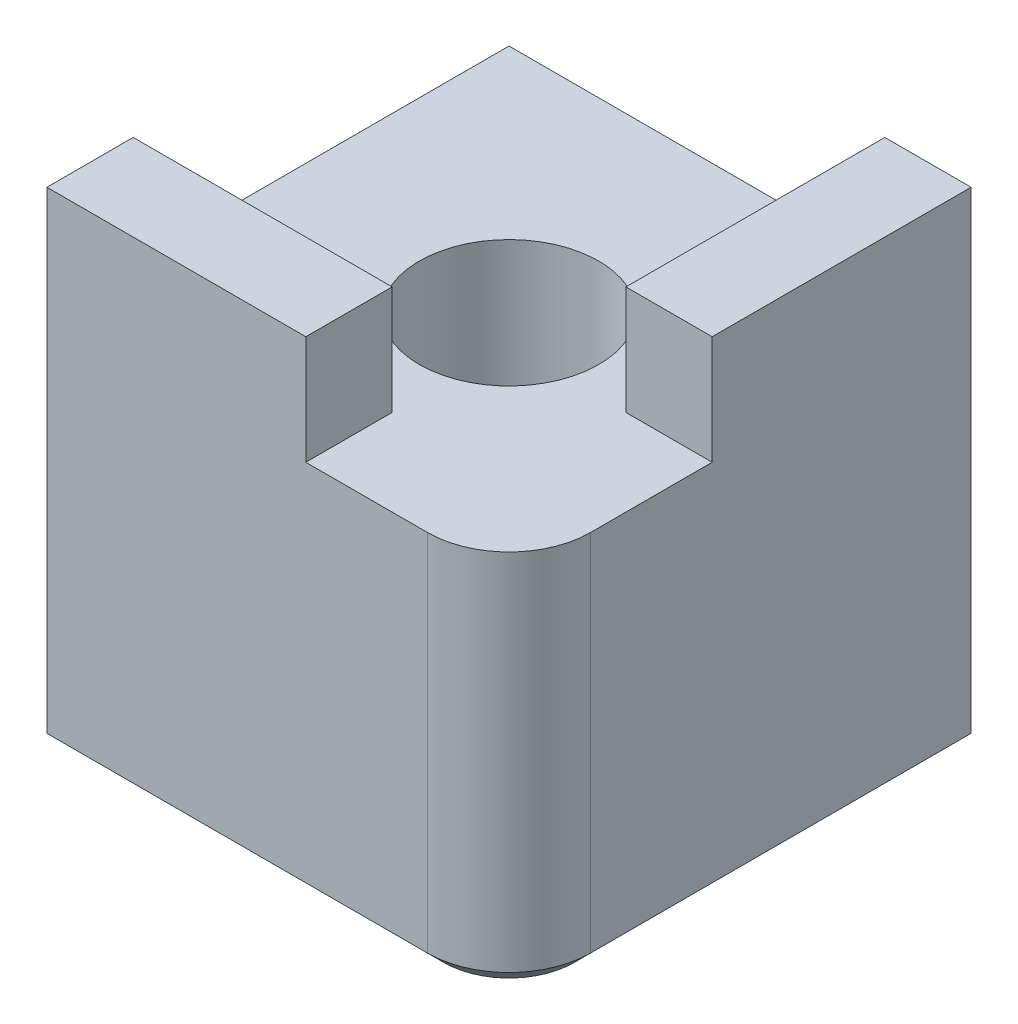
from build123d import *

# Parameters (mm, degrees)
BASE_W                = 8.5
BASE_H                = 8.5
BOSS_EXTRUDE1_DEPTH   = 8.5
CUTOUT_W              = 7
CUTOUT_H              = 7
CUT_EXTRUDE1_DEPTH    = 1.5
SKETCH3_W             = 1.5
SKETCH3_H             = 1.5
CUT_EXTRUDE2_DEPTH    = 12.803071634
FILLET3_R             = 0.508
FILLET4_R             = 1.5
M4_TAPPED_HOLE1_D     = 3.3
M4_TAPPED_HOLE1_DEPTH = 5
M4_TAPPED_HOLE1_TIP   = 0.991420021
CUT_EXTRUDE3_START    = -1.5
CUT_EXTRUDE3_DEPTH    = 1.5
CHAMFER1_SIZE         = 0.3
SKETCH15_W            = 1.5875
SKETCH15_H            = 4.7625
SKETCH15_W_2          = 4.7625
SKETCH15_H_2          = 1.5875
BOSS_EXTRUDE2_DEPTH   = 2


with BuildPart() as part:
    # Base → Boss-Extrude1 (new body)
    with BuildSketch(Plane(origin=(0, 0, 0), x_dir=(1, 0, 0), z_dir=(0, 1, 0))):
        Rectangle(BASE_W, BASE_H)
    extrude(amount=-BOSS_EXTRUDE1_DEPTH)

    # Cutout → Cut-Extrude1 (cut)
    with BuildSketch(Plane(origin=(0, 0, 0), x_dir=(1, 0, 0), z_dir=(0, 1, 0))):
        with Locations((-0.75, 0.75)):
            Rectangle(CUTOUT_W, CUTOUT_H)
    extrude(amount=-CUT_EXTRUDE1_DEPTH, mode=Mode.SUBTRACT)

    # Sketch3 → Cut-Extrude2 (cut, through all)
    with BuildSketch(Plane.ZY.offset(-2.75)):
        with Locations((-3.5, -0.75)):
            Rectangle(SKETCH3_W, SKETCH3_H)
    cut_extrude2 = extrude(amount=-CUT_EXTRUDE2_DEPTH, mode=Mode.SUBTRACT)

    # Mirror1: Cut-Extrude2 across plane
    add(cut_extrude2.mirror(Plane(origin=(0, 0, 0), x_dir=(0.7071067811865476, 0, 0.7071067811865475), z_dir=(0.7071067811865475, 0, -0.7071067811865476))), mode=Mode.SUBTRACT)

    # Fillet3
    fillet3_edges = [part.edges().sort_by_distance(p)[0] for p in [
        (2.75, -0.75, 2.75),
    ]]
    fillet(fillet3_edges, radius=FILLET3_R)

    # Fillet4
    fillet4_edges = [part.edges().sort_by_distance(p)[0] for p in [
        (4.25, -4.25, 4.25),
    ]]
    fillet(fillet4_edges, radius=FILLET4_R)

    # M4 Tapped Hole1
    with Locations(Plane(origin=(0, -1.5, 0), x_dir=(1, 0, 0), z_dir=(0, 1, 0))):
        with Locations((0, 0)):
            Hole(M4_TAPPED_HOLE1_D / 2, depth=M4_TAPPED_HOLE1_DEPTH)
            with Locations((0, 0, -(M4_TAPPED_HOLE1_DEPTH + M4_TAPPED_HOLE1_TIP / 2))):  # 118° drill point
                Cone(0, M4_TAPPED_HOLE1_D / 2, M4_TAPPED_HOLE1_TIP, mode=Mode.SUBTRACT)

    # Sketch14 → Cut-Extrude3 (cut)
    with BuildSketch(Plane(origin=(0, 0, 0), x_dir=(1, 0, 0), z_dir=(0, 1, 0)).offset(CUT_EXTRUDE3_START)):
        with BuildLine():
            Line((-2.75, -4.25), (2.75, -4.25))
            ThreePointArc((2.75, -4.25), (3.810660172, -3.810660172), (4.25, -2.75))
            Line((4.25, -2.75), (4.25, 2.75))
            Line((4.25, 2.75), (2.75, 2.75))
            Line((2.75, 2.75), (2.75, -2.242))
            ThreePointArc((2.75, -2.242), (2.601210245, -2.601210245), (2.242, -2.75))
            Line((2.242, -2.75), (-2.75, -2.75))
            Line((-2.75, -2.75), (-2.75, -4.25))
        make_face()
    extrude(amount=CUT_EXTRUDE3_DEPTH, mode=Mode.SUBTRACT)

    # Chamfer1
    chamfer1_edges = [part.edges().sort_by_distance(p)[0] for p in [
        (-4.25, -8.5, 0),
        (-0.75, -8.5, 4.25),
        (4.25, -8.5, -0.75),
        (3.810660172, -8.5, 3.810660172),
        (0, -8.5, -4.25),
    ]]
    chamfer(chamfer1_edges, length=CHAMFER1_SIZE)

    # Sketch15 → Boss-Extrude2 (add)
    with BuildSketch(Plane(origin=(0, -1.5, 0), x_dir=(1, 0, 0), z_dir=(0, 1, 0))):
        with Locations((3.45625, 1.86875)):
            Rectangle(SKETCH15_W, SKETCH15_H)
        with Locations((-1.86875, -3.45625)):
            Rectangle(SKETCH15_W_2, SKETCH15_H_2)
    extrude(amount=BOSS_EXTRUDE2_DEPTH)


solid = part.part
